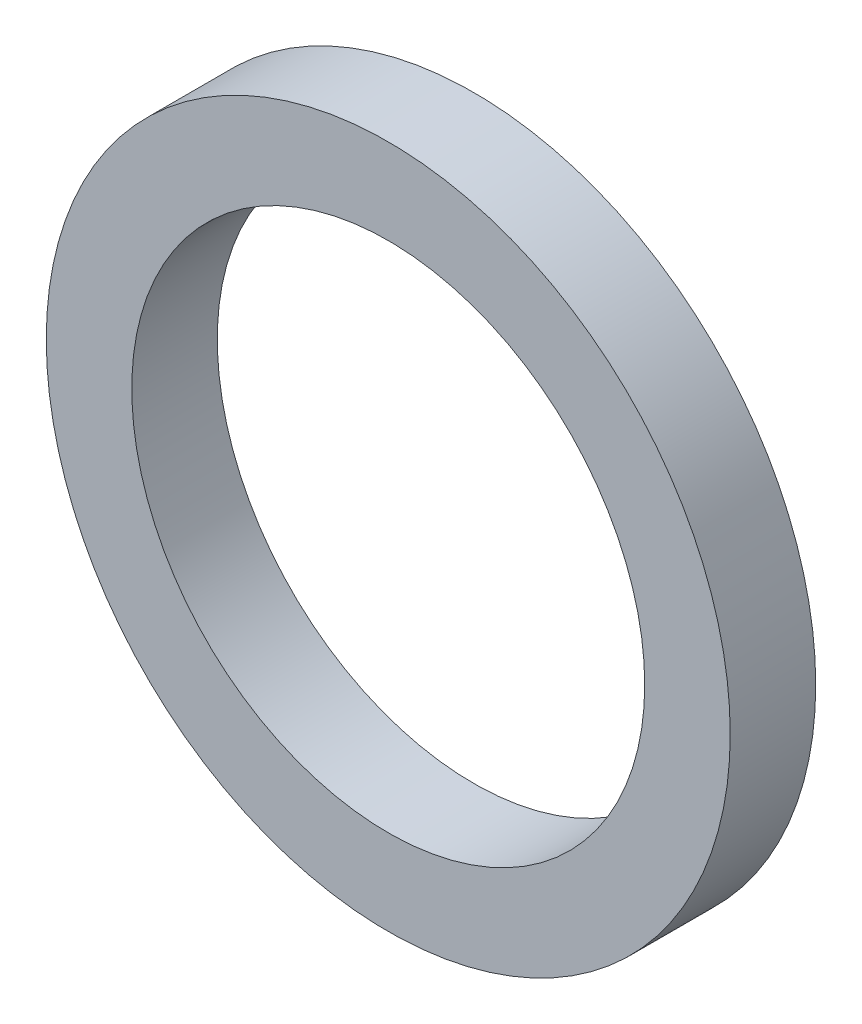
from build123d import *

# Parameters (mm, degrees)
SKETCH1_R           = 12.7
BOSS_EXTRUDE1_DEPTH = 3.175
SKETCH2_R           = 9.525
CUT_EXTRUDE1_DEPTH  = 19.238986403


with BuildPart() as part:
    # Sketch1 → Boss-Extrude1 (new body)
    with BuildSketch(Plane.XY):
        Circle(SKETCH1_R)
    extrude(amount=BOSS_EXTRUDE1_DEPTH)

    # Sketch2 → Cut-Extrude1 (cut, through all)
    with BuildSketch(Plane.XY.offset(3.175)):
        Circle(SKETCH2_R)
    extrude(amount=-CUT_EXTRUDE1_DEPTH, mode=Mode.SUBTRACT)


solid = part.part
